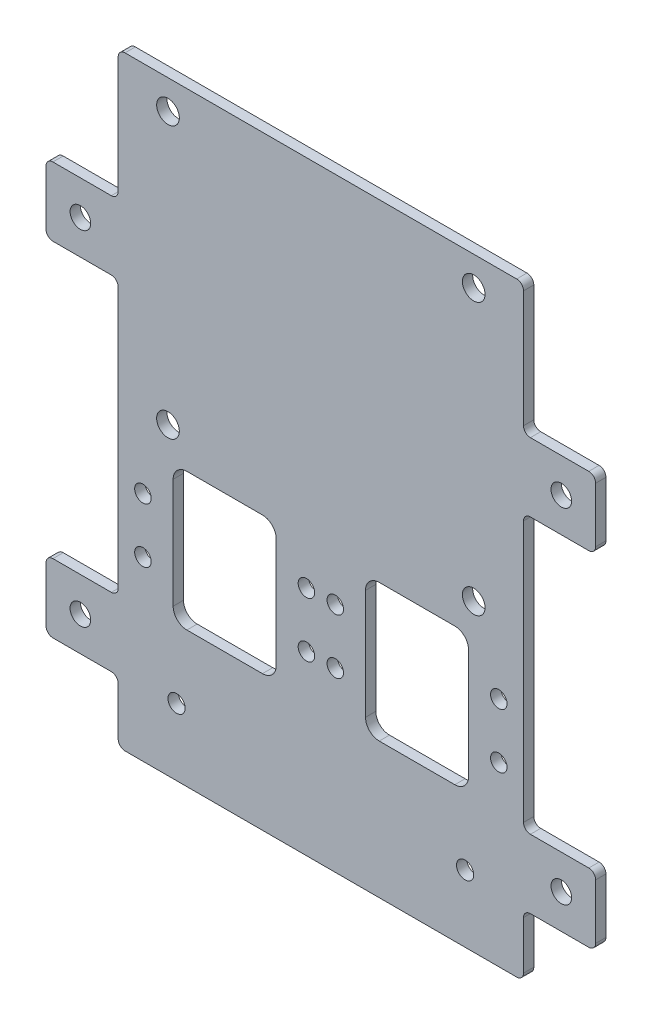
from build123d import *

# Parameters (mm, degrees)
MODEL_R         = 1.25
MODEL_R_2       = 1.65
MODEL_R_3       = 1.2
MODEL_R_4       = 1.5
EXTRUDE_1_DEPTH = 1.5


with BuildPart() as part:
    # Model → Бобышка-Вытянуть1 (new body)
    with BuildSketch(Plane.XY):
        with BuildLine():
            Line((-28.5, 0), (28.5, 0))
            ThreePointArc((28.5, 0), (29.207106781, 0.292893219), (29.5, 1))
            Line((29.5, 1), (29.5, 8))
            ThreePointArc((29.5, 8), (29.792893219, 8.707106781), (30.5, 9))
            Line((30.5, 9), (39, 9))
            ThreePointArc((39, 9), (39.707106781, 9.292893219), (40, 10))
            Line((40, 10), (40, 14))
            Line((40, 14), (40, 18))
            ThreePointArc((40, 18), (39.707106781, 18.707106781), (39, 19))
            Line((39, 19), (30.5, 19))
            ThreePointArc((30.5, 19), (29.792893219, 19.292893219), (29.5, 20))
            Line((29.5, 20), (29.5, 58))
            ThreePointArc((29.5, 58), (29.792893219, 58.707106781), (30.5, 59))
            Line((30.5, 59), (39, 59))
            ThreePointArc((39, 59), (39.707106781, 59.292893219), (40, 60))
            Line((40, 60), (40, 64))
            Line((40, 64), (40, 68))
            ThreePointArc((40, 68), (39.707106781, 68.707106781), (39, 69))
            Line((39, 69), (30.5, 69))
            ThreePointArc((30.5, 69), (29.792893219, 69.292893219), (29.5, 70))
            Line((29.5, 70), (29.5, 87))
            ThreePointArc((29.5, 87), (29.207106781, 87.707106781), (28.5, 88))
            Line((28.5, 88), (-28.5, 88))
            ThreePointArc((-28.5, 88), (-29.207106781, 87.707106781), (-29.5, 87))
            Line((-29.5, 87), (-29.5, 70))
            ThreePointArc((-29.5, 70), (-29.792893219, 69.292893219), (-30.5, 69))
            Line((-30.5, 69), (-39, 69))
            ThreePointArc((-39, 69), (-39.707106781, 68.707106781), (-40, 68))
            Line((-40, 68), (-40, 64))
            Line((-40, 64), (-40, 60))
            ThreePointArc((-40, 60), (-39.707106781, 59.292893219), (-39, 59))
            Line((-39, 59), (-30.5, 59))
            ThreePointArc((-30.5, 59), (-29.792893219, 58.707106781), (-29.5, 58))
            Line((-29.5, 58), (-29.5, 20))
            ThreePointArc((-29.5, 20), (-29.792893219, 19.292893219), (-30.5, 19))
            Line((-30.5, 19), (-39, 19))
            ThreePointArc((-39, 19), (-39.707106781, 18.707106781), (-40, 18))
            Line((-40, 18), (-40, 14))
            Line((-40, 14), (-40, 10))
            ThreePointArc((-40, 10), (-39.707106781, 9.292893219), (-39, 9))
            Line((-39, 9), (-30.5, 9))
            ThreePointArc((-30.5, 9), (-29.792893219, 8.707106781), (-29.5, 8))
            Line((-29.5, 8), (-29.5, 1))
            ThreePointArc((-29.5, 1), (-29.207106781, 0.292893219), (-28.5, 0))
        make_face()
        with Locations((-21, 9.75)):
            Circle(MODEL_R, mode=Mode.SUBTRACT)
        with Locations((-22.25, 83.75)):
            Circle(MODEL_R_2, mode=Mode.SUBTRACT)
        with Locations((-22.25, 44.25)):
            Circle(MODEL_R_2, mode=Mode.SUBTRACT)
        with Locations((-25.9, 33.75)):
            Circle(MODEL_R_3, mode=Mode.SUBTRACT)
        with Locations((-25.9, 25.75)):
            Circle(MODEL_R_3, mode=Mode.SUBTRACT)
        with Locations((-2.1, 33.75)):
            Circle(MODEL_R_3, mode=Mode.SUBTRACT)
        with Locations((-2.1, 25.75)):
            Circle(MODEL_R_3, mode=Mode.SUBTRACT)
        with Locations((2.1, 33.75)):
            Circle(MODEL_R_3, mode=Mode.SUBTRACT)
        with Locations((2.1, 25.75)):
            Circle(MODEL_R_3, mode=Mode.SUBTRACT)
        with Locations((-35, 64)):
            Circle(MODEL_R_4, mode=Mode.SUBTRACT)
        with Locations((-35, 14)):
            Circle(MODEL_R_4, mode=Mode.SUBTRACT)
        with Locations((21, 9.75)):
            Circle(MODEL_R, mode=Mode.SUBTRACT)
        with Locations((22.25, 83.75)):
            Circle(MODEL_R_2, mode=Mode.SUBTRACT)
        with Locations((22.25, 44.25)):
            Circle(MODEL_R_2, mode=Mode.SUBTRACT)
        with Locations((25.9, 33.75)):
            Circle(MODEL_R_3, mode=Mode.SUBTRACT)
        with Locations((25.9, 25.75)):
            Circle(MODEL_R_3, mode=Mode.SUBTRACT)
        with Locations((35, 64)):
            Circle(MODEL_R_4, mode=Mode.SUBTRACT)
        with Locations((35, 14)):
            Circle(MODEL_R_4, mode=Mode.SUBTRACT)
        with BuildLine():
            Line((-21.5, 37.75), (-21.5, 21.75))
            ThreePointArc((-21.5, 21.75), (-20.914213562, 20.335786438), (-19.5, 19.75))
            Line((-19.5, 19.75), (-8.5, 19.75))
            ThreePointArc((-8.5, 19.75), (-7.085786438, 20.335786438), (-6.5, 21.75))
            Line((-6.5, 21.75), (-6.5, 37.75))
            ThreePointArc((-6.5, 37.75), (-7.085786438, 39.164213562), (-8.5, 39.75))
            Line((-8.5, 39.75), (-19.5, 39.75))
            ThreePointArc((-19.5, 39.75), (-20.914213562, 39.164213562), (-21.5, 37.75))
        make_face(mode=Mode.SUBTRACT)
        with BuildLine():
            Line((19.5, 19.75), (8.5, 19.75))
            ThreePointArc((8.5, 19.75), (7.085786438, 20.335786438), (6.5, 21.75))
            Line((6.5, 21.75), (6.5, 37.75))
            ThreePointArc((6.5, 37.75), (7.085786438, 39.164213562), (8.5, 39.75))
            Line((8.5, 39.75), (19.5, 39.75))
            ThreePointArc((19.5, 39.75), (20.914213562, 39.164213562), (21.5, 37.75))
            Line((21.5, 37.75), (21.5, 21.75))
            ThreePointArc((21.5, 21.75), (20.914213562, 20.335786438), (19.5, 19.75))
        make_face(mode=Mode.SUBTRACT)
    extrude(amount=EXTRUDE_1_DEPTH)


solid = part.part
